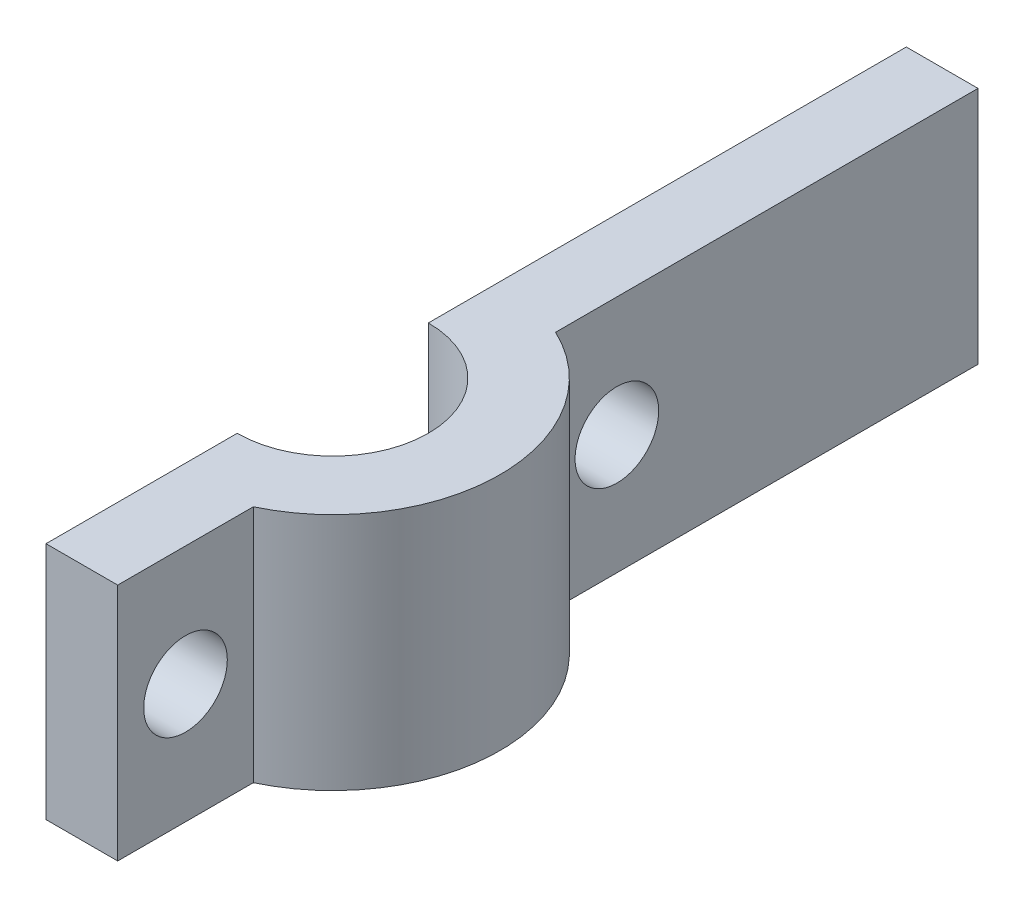
from build123d import *

# Parameters (mm, degrees)
EXTRUDE_1_DEPTH     = 10
SKETCH_2_R          = 1.75
CUT_EXTRUDE_1_DEPTH = 27.305892876


with BuildPart() as part:
    # 草图1 → 凸台-拉伸1 (new body)
    with BuildSketch(Plane(origin=(0, 0, 0), x_dir=(1, 0, 0), z_dir=(0, 1, 0))):
        with BuildLine():
            Line((0, 24), (0, 4))
            ThreePointArc((0, 4), (4, 0), (0, -4))
            Line((0, -4), (0, -12))
            Line((0, -12), (3, -12))
            Line((3, -12), (3, -6.32455532))
            ThreePointArc((3, -6.32455532), (7, 0), (3, 6.32455532))
            Line((3, 6.32455532), (3, 24))
            Line((3, 24), (0, 24))
        make_face()
    extrude(amount=EXTRUDE_1_DEPTH)

    # 草图2 → 切除-拉伸1 (cut, through all)
    with BuildSketch(Plane(origin=(3, 0, 0), x_dir=(0, 0, -1), z_dir=(1, 0, 0))):
        with Locations((-9.16227766, 5)):
            Circle(SKETCH_2_R)
        with Locations((8.888984546, 5)):
            Circle(SKETCH_2_R)
    extrude(amount=-CUT_EXTRUDE_1_DEPTH, mode=Mode.SUBTRACT)


solid = part.part
